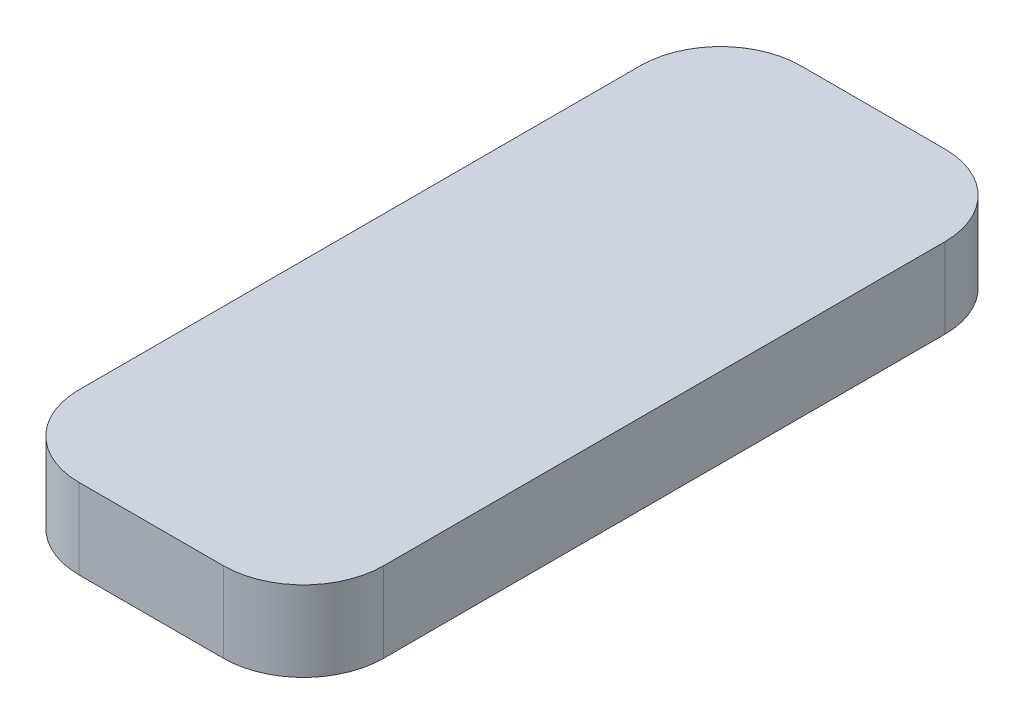
from build123d import *

# Parameters (mm, degrees)
SKETCH1_R                = 38
BOSS_EXTRUDE1_DEPTH      = 80
SKETCH2_R                = 29
CUT_EXTRUDE1_DEPTH       = 75
BOSS_EXTRUDE2_DEPTH      = 20
ESBO_O1_W                = 76
ESBO_O1_H                = 80
CORTE_EXTRUS_O1_DEPTH    = 155.518607294
ESBO_O2_W                = 2.5
ESBO_O2_H                = 49
RESSALTO_EXTRUS_O1_DEPTH = 5.4
ESBO_O3_R                = 1.35
CORTE_EXTRUS_O2_DEPTH    = 147.505972574
FILETE1_R                = 2


with BuildPart() as part:
    # Sketch1 → Boss-Extrude1 (new body)
    with BuildSketch(Plane(origin=(0, 0, 0), x_dir=(1, 0, 0), z_dir=(0, 1, 0))):
        with Locations(Location((0, 0, 0), (0, 0, 270))):
            Circle(SKETCH1_R)
    extrude(amount=BOSS_EXTRUDE1_DEPTH)

    # Sketch2 → Cut-Extrude1 (cut)
    with BuildSketch(Plane.XZ):
        with Locations(Location((0, 0, 0), (0, 0, 270))):
            Circle(SKETCH2_R)
    extrude(amount=-CUT_EXTRUDE1_DEPTH, mode=Mode.SUBTRACT)

    # Sketch3 → Boss-Extrude2 (add)
    with BuildSketch(Plane(origin=(0, 80, 0), x_dir=(1, 0, 0), z_dir=(0, 1, 0))):
        with BuildLine():
            Line((18, -90), (-18, -90))
            ThreePointArc((-18, -90), (-32.142135624, -84.142135624), (-38, -70))
            Line((-38, -70), (-38, 70))
            ThreePointArc((-38, 70), (-32.142135624, 84.142135624), (-18, 90))
            Line((-18, 90), (18, 90))
            ThreePointArc((18, 90), (32.142135624, 84.142135624), (38, 70))
            Line((38, 70), (38, -70))
            ThreePointArc((38, -70), (32.142135624, -84.142135624), (18, -90))
        make_face()
    extrude(amount=BOSS_EXTRUDE2_DEPTH)

    # Esboço1 → Corte-extrusão1 (cut, through all)
    with BuildSketch(Plane(origin=(38, 0, 0), x_dir=(0, 0, -1), z_dir=(1, 0, 0))):
        with Locations((0, 40)):
            Rectangle(ESBO_O1_W, ESBO_O1_H)
    extrude(amount=-CORTE_EXTRUS_O1_DEPTH, mode=Mode.SUBTRACT)

    # Esboço2 → Ressalto-extrusão1 (add)
    with BuildSketch(Plane.XZ.offset(-80)):
        with Locations((18.75, 0)):
            Rectangle(ESBO_O2_W, ESBO_O2_H)
        with Locations((-18.75, 0)):
            Rectangle(ESBO_O2_W, ESBO_O2_H)
    extrude(amount=RESSALTO_EXTRUS_O1_DEPTH)

    # Esboço3 → Corte-extrusão2 (cut, through all)
    with BuildSketch(Plane(origin=(20, 0, 0), x_dir=(0, 0, -1), z_dir=(1, 0, 0))):
        with Locations((22, 77.3)):
            Circle(ESBO_O3_R)
        with Locations((0, 77.3)):
            Circle(ESBO_O3_R)
        with Locations((-22, 77.3)):
            Circle(ESBO_O3_R)
    extrude(amount=-CORTE_EXTRUS_O2_DEPTH, mode=Mode.SUBTRACT)

    # Filete1
    filete1_edges = [part.edges().sort_by_distance(p)[0] for p in [
        (18.75, 74.6, -24.5),
        (18.75, 74.6, 24.5),
        (-18.75, 74.6, -24.5),
        (-18.75, 74.6, 24.5),
    ]]
    fillet(filete1_edges, radius=FILETE1_R)


solid = part.part
